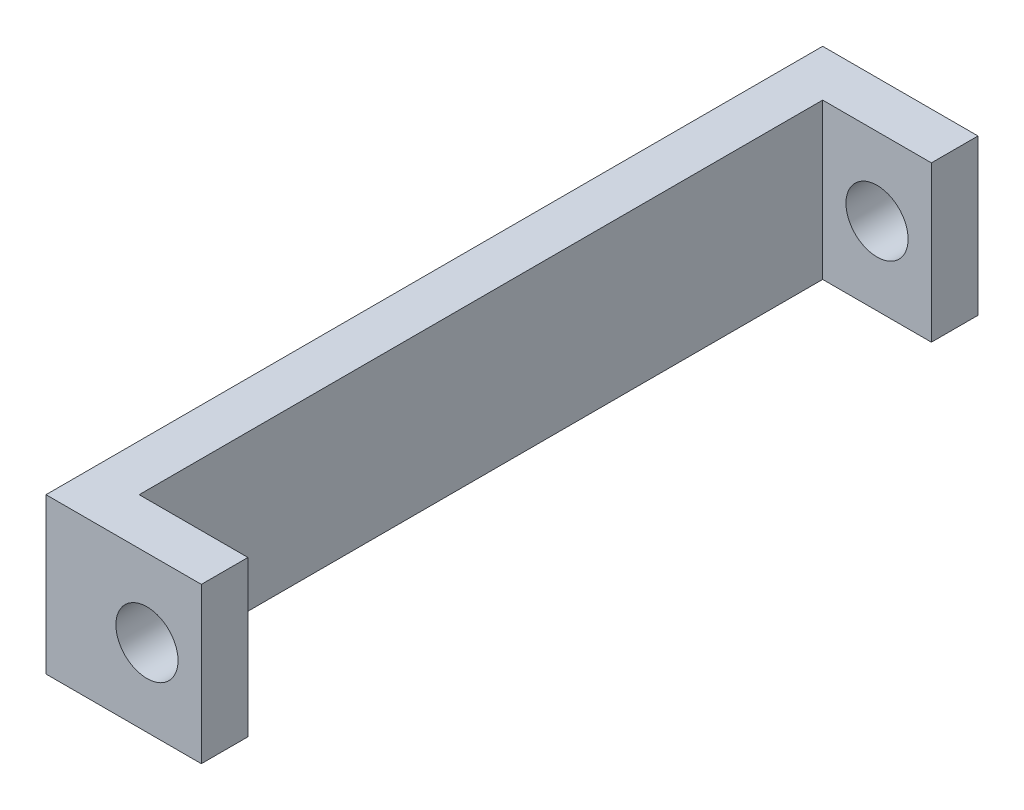
from build123d import *

# Parameters (mm, degrees)
SKETCH1_W           = 10
SKETCH1_H           = 10
BOSS_EXTRUDE1_DEPTH = 50
SKETCH2_W           = 7
SKETCH2_H           = 44
CUT_EXTRUDE1_DEPTH  = 11
SKETCH3_R           = 2
CUT_EXTRUDE2_DEPTH  = 71


with BuildPart() as part:
    # Sketch1 → Boss-Extrude1 (new body)
    with BuildSketch(Plane.XY):
        Rectangle(SKETCH1_W, SKETCH1_H)
    extrude(amount=BOSS_EXTRUDE1_DEPTH)

    # Sketch2 → Cut-Extrude1 (cut)
    with BuildSketch(Plane(origin=(0, 5, 0), x_dir=(1, 0, 0), z_dir=(0, 1, 0))):
        with Locations((1.5, -25)):
            Rectangle(SKETCH2_W, SKETCH2_H)
    extrude(amount=-CUT_EXTRUDE1_DEPTH, mode=Mode.SUBTRACT)

    # Sketch3 → Cut-Extrude2 (cut)
    with BuildSketch(Plane.XY.offset(50)):
        with Locations((1.5, 0)):
            Circle(SKETCH3_R)
    extrude(amount=-CUT_EXTRUDE2_DEPTH, mode=Mode.SUBTRACT)


solid = part.part
